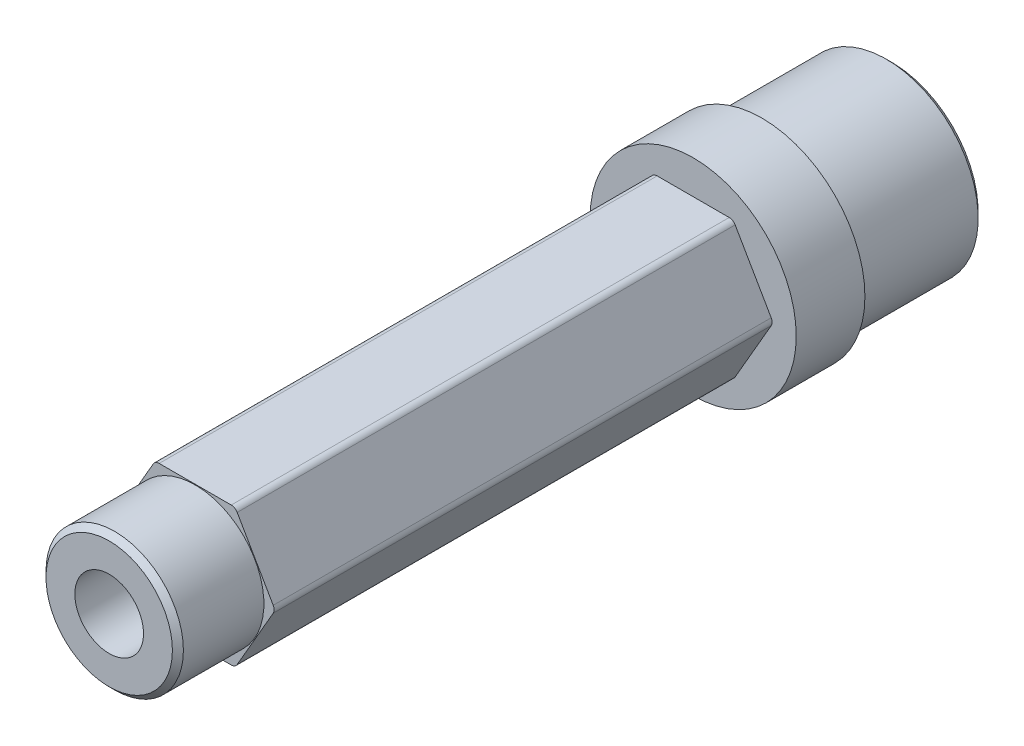
from build123d import *

# Parameters (mm, degrees)
SKETCH3_OUTSIDE_W  = 36.488
SKETCH3_OUTSIDE_H  = 36.488
CUT_EXTRUDE1_DEPTH = 46.03250001
CHAMFER1_SIZE      = 0.508
FILLET1_R          = 0.635


with BuildPart() as part:
    # Sketch2 → Revolve1 (revolve)
    with BuildSketch(Plane(origin=(0, 0, 0), x_dir=(0, 0, -1), z_dir=(1, 0, 0)), mode=Mode.PRIVATE) as revolve1_sk:
        Polygon((0, 3.175), (0, 6.35), (7.9502, 6.35), (7.9502, 7.62), (53.98270001, 7.62), (53.98270001, 9.525), (60.33270001, 9.525), (60.33270001, 8.5), (72.33270001, 8.5), (72.33270001, 0), (6.858, 0), (6.858, 3.175), align=None)
    revolve(revolve1_sk.sketch.rotate(Axis((0, 0, 0), (0, 0, 1)), 90), axis=Axis((0, 0, 0), (0, 0, 1)))

    # Sketch3 outside → Cut-Extrude1 (cut)
    with BuildSketch(Plane.XY.offset(-7.9502)):
        Rectangle(SKETCH3_OUTSIDE_W, SKETCH3_OUTSIDE_H)
        Polygon((3.696970073, 6.40334), (-3.696970073, 6.40334), (-7.393940145, 0), (-3.696970073, -6.40334), (3.696970073, -6.40334), (7.393940145, 0), align=None, mode=Mode.SUBTRACT)
    extrude(amount=-CUT_EXTRUDE1_DEPTH, mode=Mode.SUBTRACT)

    # Chamfer1
    chamfer1_edges = [part.edges().sort_by_distance(p)[0] for p in [
        (8.5, 0, -72.33270001),
        (6.35, 0, 0),
    ]]
    chamfer(chamfer1_edges, length=CHAMFER1_SIZE)

    # Fillet1
    fillet1_edges = [part.edges().sort_by_distance(p)[0] for p in [
        (3.696970073, 6.40334, -30.966450005),
        (-3.696970073, 6.40334, -30.966450005),
        (-7.393940145, 0, -30.966450005),
        (-3.696970073, -6.40334, -30.966450005),
        (3.696970073, -6.40334, -30.966450005),
        (7.393940145, 0, -30.966450005),
    ]]
    fillet(fillet1_edges, radius=FILLET1_R)


solid = part.part
